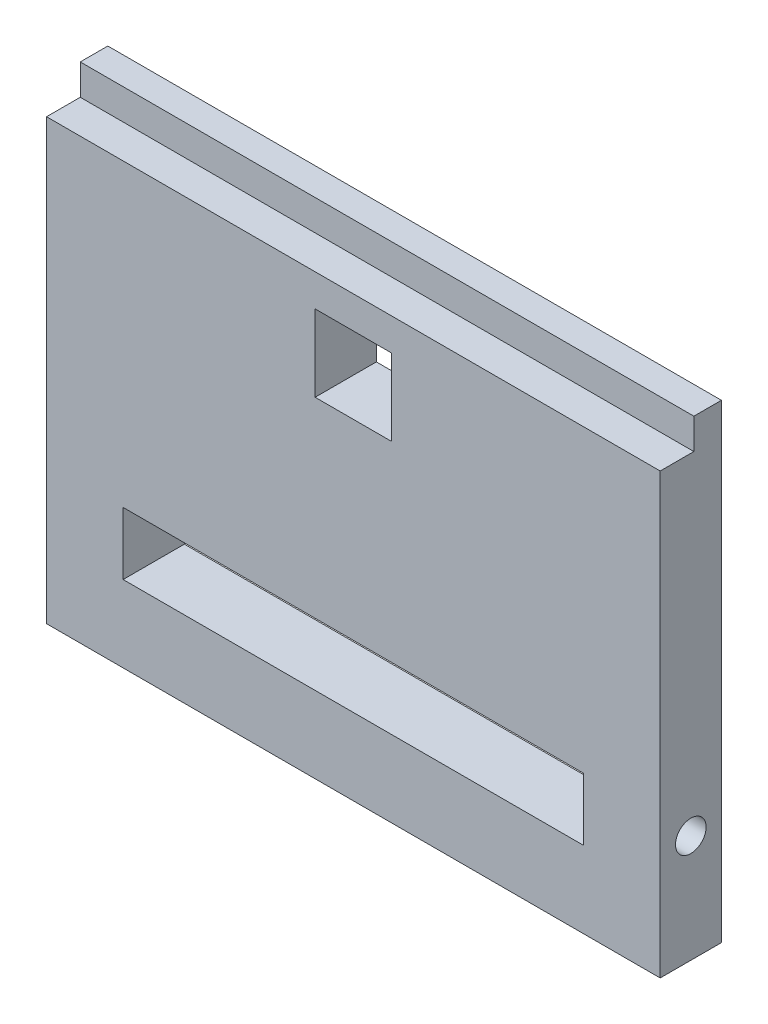
from build123d import *

# Parameters (mm, degrees)
SKETCH2_W               = 200.4
SKETCH2_H               = 153.4
SKETCH2_W_2             = 150.4
SKETCH2_H_2             = 20.4
BOSS_EXTRUDE1_DEPTH     = 10
CUT_EXTRUDE1_REACH      = 234.876
SKETCH4_R               = 5
CUT_EXTRUDE2_DEPTH      = 157.241095746
CUT_EXTRUDE2_DEPTH_BACK = 157.241095746
SKETCH7_W               = 25
SKETCH7_H               = 25
SKETCH8_W               = 200.4
SKETCH8_H               = 11
CUT_EXTRUDE3_DEPTH      = 10


with BuildPart() as part:
    # Sketch2 → Boss-Extrude1 (new, symmetric)
    with BuildSketch(Plane.XY):
        with Locations((0, 41.5)):
            Rectangle(SKETCH2_W, SKETCH2_H)
        Rectangle(SKETCH2_W_2, SKETCH2_H_2, mode=Mode.SUBTRACT)
    extrude(amount=BOSS_EXTRUDE1_DEPTH, both=True)

    # Sketch4 → Cut-Extrude1 (cut, up to next)
    with BuildSketch(Plane(origin=(100.2, 0, 0), x_dir=(0, 0, -1), z_dir=(1, 0, 0)), mode=Mode.PRIVATE) as cut_extrude1_sk1:
        Circle(SKETCH4_R)
    cut_extrude1_tool1 = extrude(cut_extrude1_sk1.sketch, amount=-CUT_EXTRUDE1_REACH, mode=Mode.PRIVATE) & part.part
    add(cut_extrude1_tool1.solids().sort_by_distance((100.2, 0, 0))[0], mode=Mode.SUBTRACT)

    # Sketch7 → Cut-Extrude2 (cut, two sides: drawn at the far end of the back side and taken through both)
    with BuildSketch(Plane.XY.offset(10).offset(-CUT_EXTRUDE2_DEPTH_BACK)):
        with Locations((0, 85.2)):
            Rectangle(SKETCH7_W, SKETCH7_H)
    extrude(amount=CUT_EXTRUDE2_DEPTH + CUT_EXTRUDE2_DEPTH_BACK, mode=Mode.SUBTRACT)

    # Sketch8 → Cut-Extrude3 (cut)
    with BuildSketch(Plane(origin=(0, 118.2, 0), x_dir=(1, 0, 0), z_dir=(0, 1, 0))):
        with Locations((0, -4.5)):
            Rectangle(SKETCH8_W, SKETCH8_H)
    extrude(amount=-CUT_EXTRUDE3_DEPTH, mode=Mode.SUBTRACT)


solid = part.part
